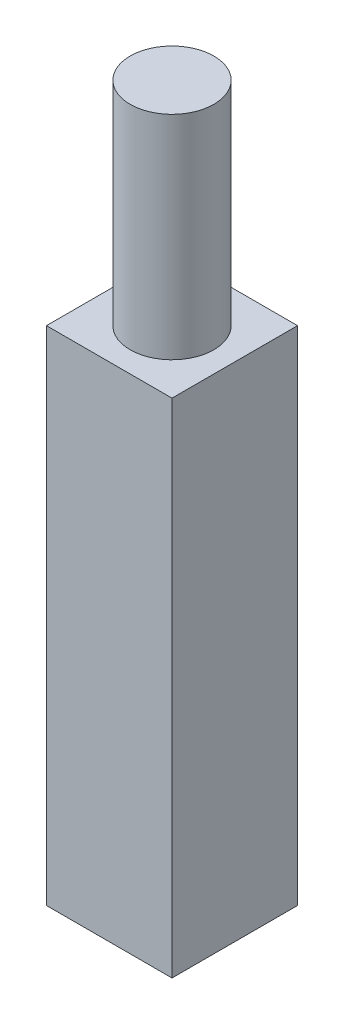
from build123d import *

# Parameters (mm, degrees)
SKETCH1_W           = 15
SKETCH1_H           = 15
BOSS_EXTRUDE1_DEPTH = 60
SKETCH2_R           = 5
BOSS_EXTRUDE2_DEPTH = 25.4


with BuildPart() as part:
    # Sketch1 → Boss-Extrude1 (new body)
    with BuildSketch(Plane(origin=(0, 0, 0), x_dir=(1, 0, 0), z_dir=(0, 1, 0))):
        Rectangle(SKETCH1_W, SKETCH1_H)
    extrude(amount=BOSS_EXTRUDE1_DEPTH)

    # Sketch2 → Boss-Extrude2 (add)
    with BuildSketch(Plane(origin=(0, 60, 0), x_dir=(1, 0, 0), z_dir=(0, 1, 0))):
        with Locations(Location((0, 0, 0), (0, 0, 270))):
            Circle(SKETCH2_R)
    extrude(amount=BOSS_EXTRUDE2_DEPTH)


solid = part.part
